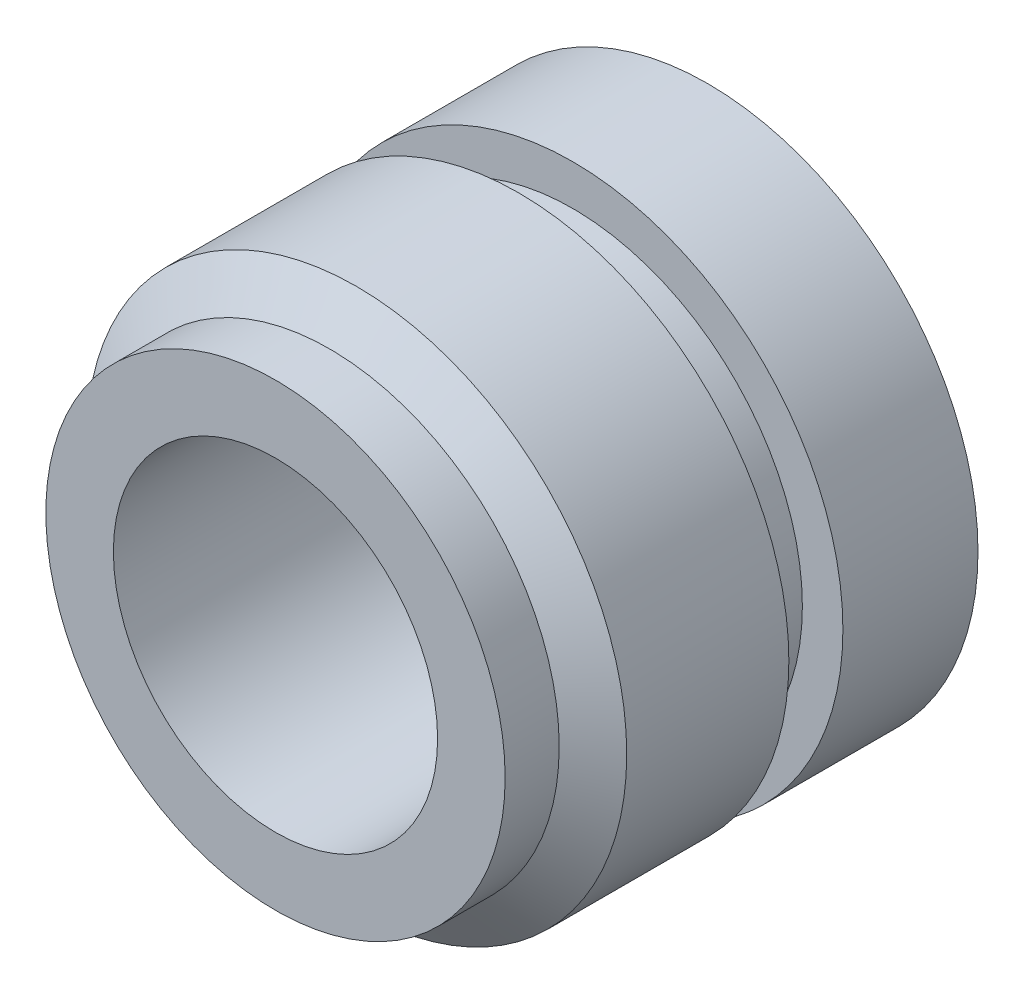
from build123d import *

# Parameters (mm, degrees)
SKETCH1_R           = 2.5
BOSS_EXTRUDE1_DEPTH = 4
SKETCH3_R           = 1.5
CUT_EXTRUDE1_DEPTH  = 5
CHAMFER1_SIZE       = 0.1


with BuildPart() as part:
    # Sketch1 → Boss-Extrude1 (new body)
    with BuildSketch(Plane.XY):
        Circle(SKETCH1_R)
    extrude(amount=BOSS_EXTRUDE1_DEPTH)

    # Sketch2 → Cut-Revolve1 (revolve, cut)
    with BuildSketch(Plane(origin=(0, 0, 0), x_dir=(1, 0, 0), z_dir=(0, 1, 0)), mode=Mode.PRIVATE) as cut_revolve1_sk:
        Polygon((-2.125, -4), (-3, -4), (-3, 0), (-2.5, 0), (-2.5, -1.25), (-2.125, -1.25), (-2.125, -1.75), (-2.5, -1.75), (-2.5, -3.25), (-2.125, -3.5), align=None)
    revolve(cut_revolve1_sk.sketch.rotate(Axis((0, 0, 4), (0, 0, -1)), 180), axis=Axis((0, 0, 4), (0, 0, -1)), mode=Mode.SUBTRACT)

    # Sketch3 → Cut-Extrude1 (cut)
    with BuildSketch(Plane(origin=(0, 0, 0), x_dir=(-1, 0, 0), z_dir=(0, 0, -1))):
        Circle(SKETCH3_R)
    extrude(amount=-CUT_EXTRUDE1_DEPTH, mode=Mode.SUBTRACT)

    # Chamfer1
    chamfer1_edges = [part.edges().sort_by_distance(p)[0] for p in [
        (1.5, 0, 0),
    ]]
    chamfer(chamfer1_edges, length=CHAMFER1_SIZE)


solid = part.part
